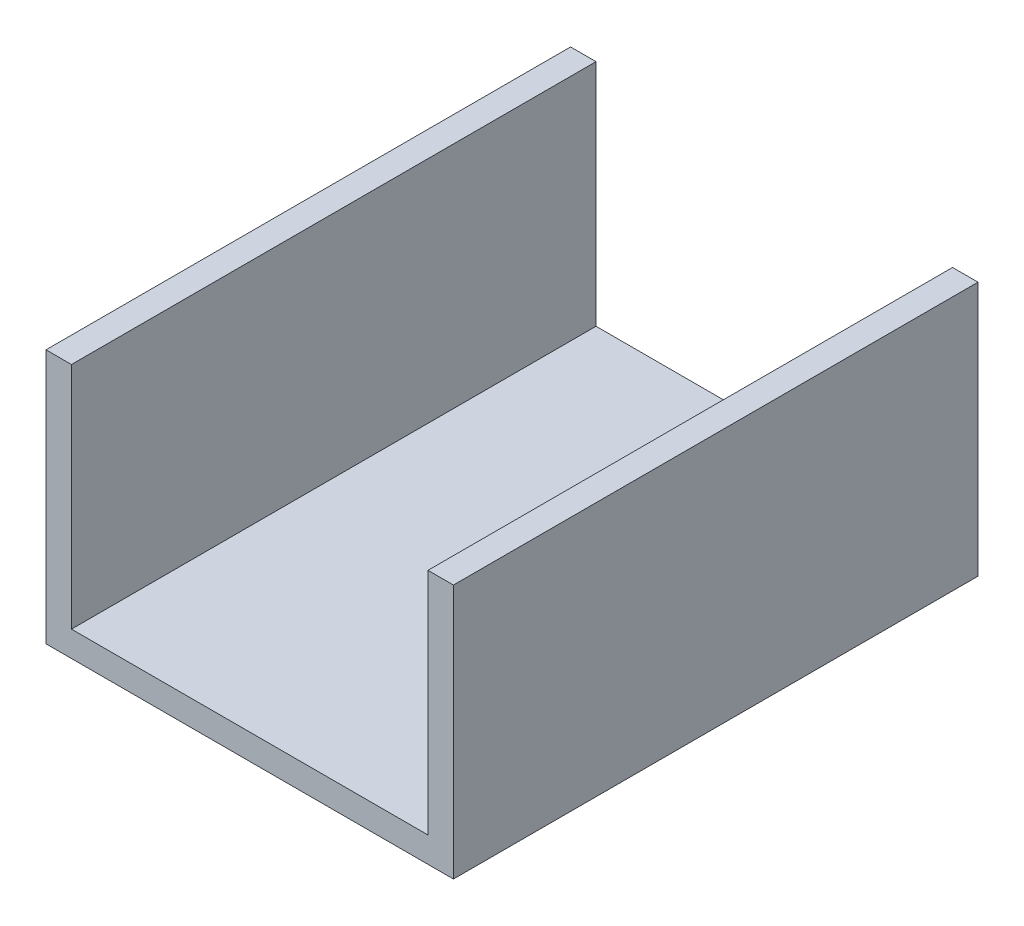
from build123d import *

# Parameters (mm, degrees)
Y_KSEKLIK_EKSTR_ZYON1_DEPTH = 103


with BuildPart() as part:
    # Çizim1 → Yükseklik-Ekstrüzyon1 (new body)
    with BuildSketch(Plane.XY):
        Polygon((0, 0), (80, 0), (80, 50), (75, 50), (75, 5), (5, 5), (5, 50), (0, 50), align=None)
    extrude(amount=Y_KSEKLIK_EKSTR_ZYON1_DEPTH)


solid = part.part
